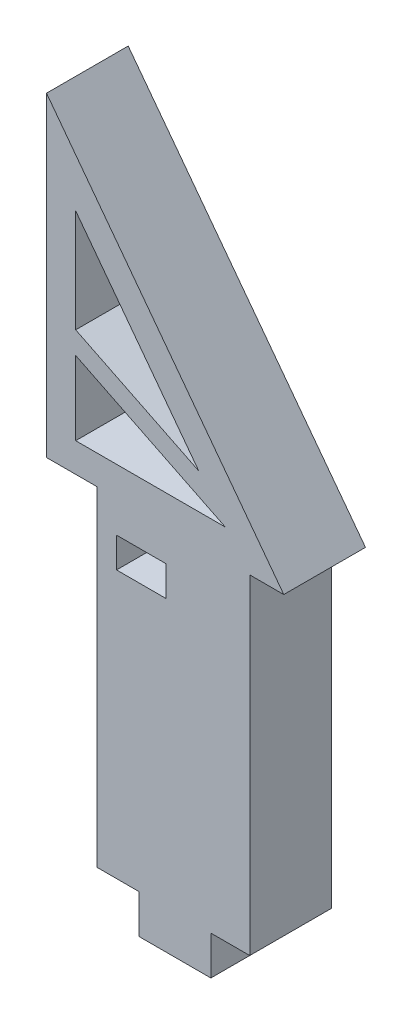
from build123d import *

# Parameters (mm, degrees)
SKETCH_1_W          = 15.7
SKETCH_1_H          = 8.4
EXTRUDE_1_DEPTH     = 37.9
EXTRUDE_2_DEPTH     = 8.4
CUT_EXTRUDE_1_DEPTH = 73.041550511
SKETCH_4_W          = 4.3
SKETCH_4_H          = 4
SKETCH_4_W_2        = 4
CUT_EXTRUDE_2_DEPTH = 73.041550511
SKETCH_5_W          = 5.1
SKETCH_5_H          = 3.1
CUT_EXTRUDE_3_DEPTH = 73.041550511


with BuildPart() as part:
    # ｽｹｯﾁ1 → ﾎﾞｽ - 押し出し1 (new body)
    with BuildSketch(Plane(origin=(0, 0, 0), x_dir=(1, 0, 0), z_dir=(0, 1, 0))):
        Rectangle(SKETCH_1_W, SKETCH_1_H)
    extrude(amount=EXTRUDE_1_DEPTH)

    # ｽｹｯﾁ2 → ﾎﾞｽ - 押し出し2 (add)
    with BuildSketch(Plane.XY.offset(4.2)):
        Polygon((-13.05, 37.9), (11.35, 37.9), (-13.05, 70.35), align=None)
    extrude(amount=-EXTRUDE_2_DEPTH)

    # ｽｹｯﾁ3 → ｶｯﾄ - 押し出し1 (cut, through all)
    with BuildSketch(Plane(origin=(0, 0, -4.2), x_dir=(-1, 0, 0), z_dir=(0, 0, -1))):
        Polygon((10.05, 61.368438838), (-2.610871129, 44.530518012), (10.05, 50.772247606), align=None)
        Polygon((-5.340752161, 40.9), (10.05, 40.9), (10.05, 48.487543721), align=None)
    extrude(amount=-CUT_EXTRUDE_1_DEPTH, mode=Mode.SUBTRACT)

    # ｽｹｯﾁ4 → ｶｯﾄ - 押し出し2 (cut, through all)
    with BuildSketch(Plane(origin=(0, 0, -4.2), x_dir=(-1, 0, 0), z_dir=(0, 0, -1))):
        with Locations((5.7, 2)):
            Rectangle(SKETCH_4_W, SKETCH_4_H)
        with Locations((-5.85, 2)):
            Rectangle(SKETCH_4_W_2, SKETCH_4_H)
    extrude(amount=-CUT_EXTRUDE_2_DEPTH, mode=Mode.SUBTRACT)

    # ｽｹｯﾁ5 → ｶｯﾄ - 押し出し3 (cut, through all)
    with BuildSketch(Plane(origin=(0, 0, -4.2), x_dir=(-1, 0, 0), z_dir=(0, 0, -1))):
        with Locations((3.3, 33.04)):
            Rectangle(SKETCH_5_W, SKETCH_5_H)
    extrude(amount=-CUT_EXTRUDE_3_DEPTH, mode=Mode.SUBTRACT)


solid = part.part
